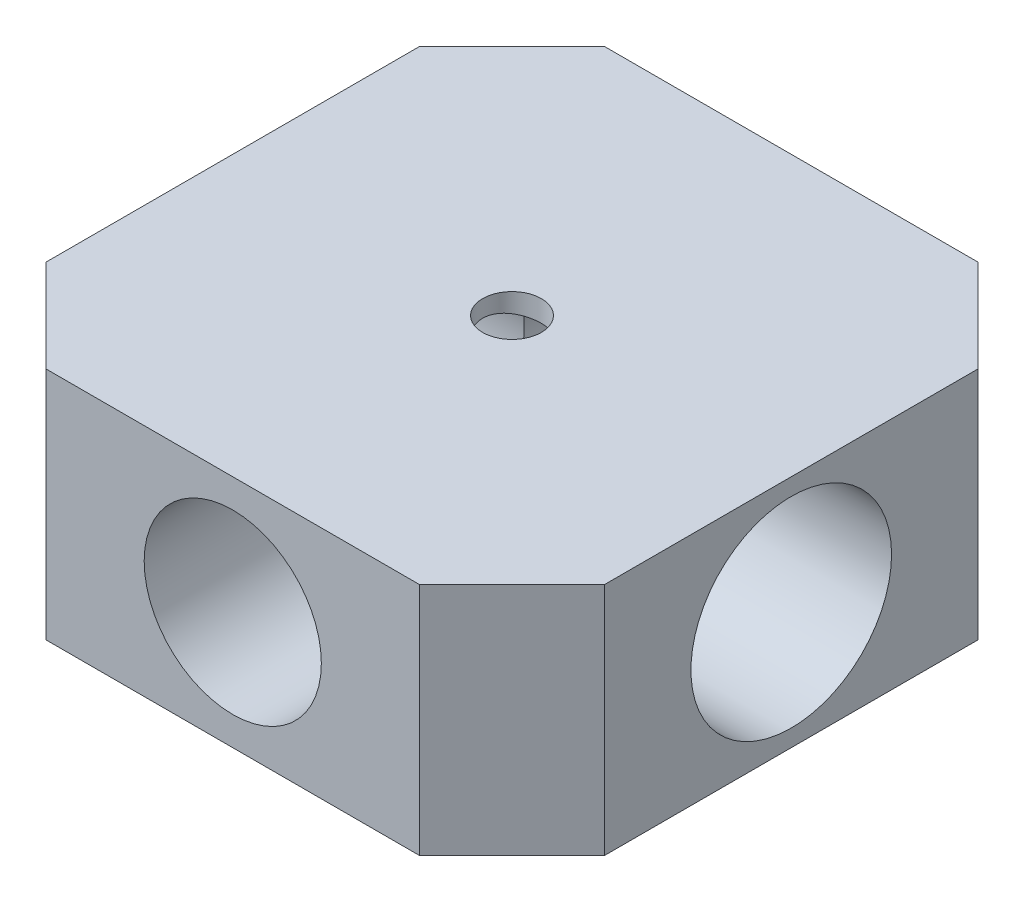
from build123d import *

# Parameters (mm, degrees)
BOSS_EXTRUDE1_DEPTH     = 20
CUT_EXTRUDE1_DEPTH      = 58.271284253
CUT_EXTRUDE1_DEPTH_BACK = 58.271284253
SKETCH2_R               = 7.55
CUT_EXTRUDE2_DEPTH      = 58.271284253
CUT_EXTRUDE2_DEPTH_BACK = 58.271284253
SKETCH3_R               = 8.55
CUT_EXTRUDE3_DEPTH      = 40.395431329
CUT_EXTRUDE3_DEPTH_BACK = 40.395431329
SKETCH4_R               = 2.5
CUT_EXTRUDE4_DEPTH      = 40.39543138


with BuildPart() as part:
    # Sketch1 → Boss-Extrude1 (new body)
    with BuildSketch(Plane(origin=(0, 0, 0), x_dir=(1, 0, 0), z_dir=(0, 1, 0))):
        Polygon((-24, 16), (-16, 24), (16, 24), (24, 16), (24, -16), (16, -24), (-16, -24), (-24, -16), align=None)
    extrude(amount=BOSS_EXTRUDE1_DEPTH)

    # Sketch2 → Cut-Extrude1 (cut, two sides: drawn at the far end of the back side and taken through both)
    with BuildSketch(Plane.XY.offset(24).offset(-CUT_EXTRUDE1_DEPTH_BACK)):
        with Locations((0, 10)):
            Circle(SKETCH2_R)
    extrude(amount=CUT_EXTRUDE1_DEPTH + CUT_EXTRUDE1_DEPTH_BACK, mode=Mode.SUBTRACT)

    # Sketch3 → Cut-Extrude2 (cut, two sides: drawn at the far end of the back side and taken through both)
    with BuildSketch(Plane(origin=(24, 0, 0), x_dir=(0, 0, -1), z_dir=(1, 0, 0)).offset(-CUT_EXTRUDE2_DEPTH_BACK)):
        with Locations((0, 10)):
            Circle(SKETCH3_R)
    extrude(amount=CUT_EXTRUDE2_DEPTH + CUT_EXTRUDE2_DEPTH_BACK, mode=Mode.SUBTRACT)

    # Sketch4 → Cut-Extrude3 (cut, two sides: drawn at the far end of the back side and taken through both)
    with BuildSketch(Plane(origin=(0, 20, 0), x_dir=(1, 0, 0), z_dir=(0, 1, 0)).offset(-CUT_EXTRUDE3_DEPTH_BACK)):
        with Locations(Location((0, 0, 0), (0, 0, 270))):
            Circle(SKETCH4_R)
    extrude(amount=CUT_EXTRUDE3_DEPTH + CUT_EXTRUDE3_DEPTH_BACK, mode=Mode.SUBTRACT)

    # Sketch5 → Cut-Extrude4 (cut, through all)
    with BuildSketch(Plane(origin=(0, 20, 0), x_dir=(1, 0, 0), z_dir=(0, 1, 0))):
        Polygon((-24, 16), (-24, -16), (-16, -24), (16, -24), (24, -16), (24, 16), (16, 24), (-16, 24), align=None)
        Polygon((-23.8, 15.917157288), (-23.8, -15.917157288), (-15.917157288, -23.8), (15.917157288, -23.8), (23.8, -15.917157288), (23.8, 15.917157288), (15.917157288, 23.8), (-15.917157288, 23.8), align=None, mode=Mode.SUBTRACT)
    extrude(amount=-CUT_EXTRUDE4_DEPTH, mode=Mode.SUBTRACT)


solid = part.part
